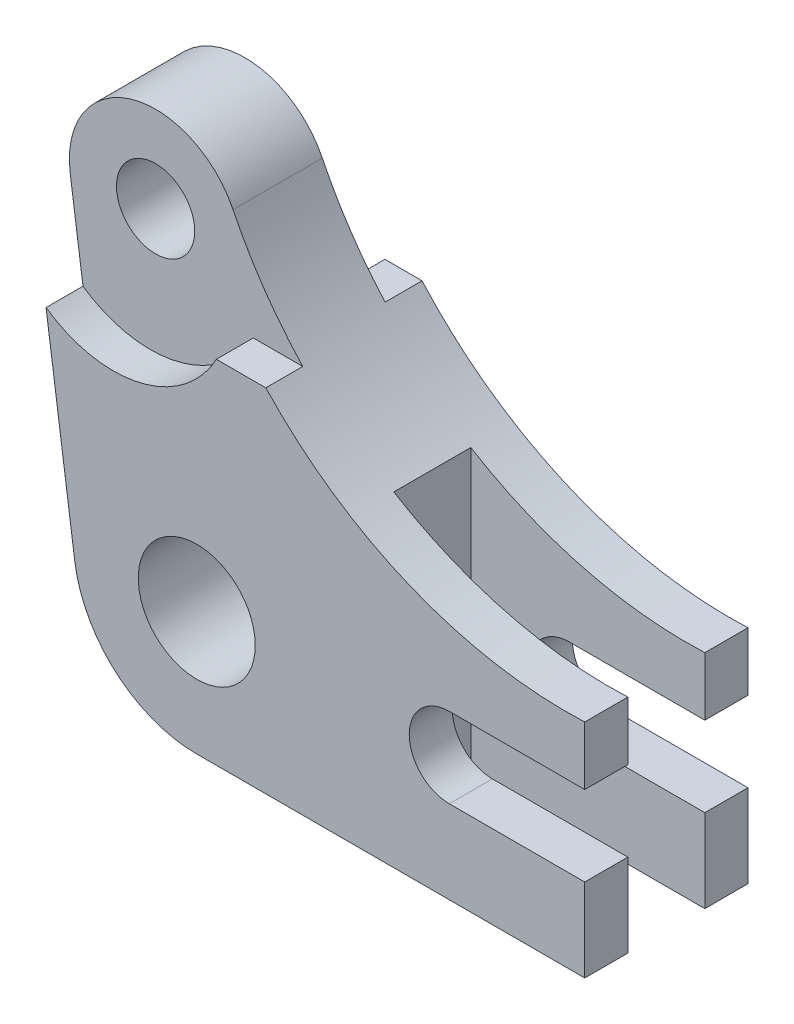
from build123d import *

# Parameters (mm, degrees)
SKETCH1_R           = 9.5
SKETCH1_R_2         = 6.35
BOSS_EXTRUDE1_DEPTH = 26.5
SKETCH4_W           = 12.5
SKETCH4_H           = 9.5
SKETCH4_H_2         = 13
SKETCH4_H_3         = 13.5
CUT_EXTRUDE2_DEPTH  = 38
SKETCH8_W           = 32.145016969
SKETCH8_H           = 12.5
CUT_EXTRUDE3_DEPTH  = 83.012755321
CUT_EXTRUDE4_START  = -6
SKETCH9_R           = 6.35
CUT_EXTRUDE4_DEPTH  = 6
SKETCH10_R          = 6.35
CUT_EXTRUDE5_DEPTH  = 6


with BuildPart() as part:
    # Sketch1 → Boss-Extrude1 (new body)
    with BuildSketch(Plane.XY):
        with BuildLine():
            Line((0, -20), (63, -20))
            Line((63, -20), (63, -6.5))
            Line((63, -6.5), (41, -6.5))
            ThreePointArc((41, -6.5), (34.5, 0), (41, 6.5))
            Line((41, 6.5), (63, 6.5))
            Line((63, 6.5), (63, 16))
            ThreePointArc((63, 16), (25.856630594, 25.331553649), (-0.107256868, 53.484427966))
            ThreePointArc((-0.107256868, 53.484427966), (-16.780403102, 60.717082184), (-26.547021707, 45.390038979))
            Line((-26.547021707, 45.390038979), (-19.806983567, -2.771895014))
            ThreePointArc((-19.806983567, -2.771895014), (-13.125587601, -15.09035951), (0, -20))
        make_face()
        Circle(SKETCH1_R, mode=Mode.SUBTRACT)
        with Locations((-12.68213321, 47.330365488)):
            Circle(SKETCH1_R_2, mode=Mode.SUBTRACT)
    extrude(amount=BOSS_EXTRUDE1_DEPTH)

    # Sketch4 → Cut-Extrude2 (cut)
    with BuildSketch(Plane(origin=(63, 0, 0), x_dir=(0, 0, -1), z_dir=(1, 0, 0))):
        with Locations((-13.25, 11.25)):
            Rectangle(SKETCH4_W, SKETCH4_H)
        with Locations((-13.25, 0)):
            Rectangle(SKETCH4_W, SKETCH4_H_2)
        with Locations((-13.25, -13.25)):
            Rectangle(SKETCH4_W, SKETCH4_H_3)
    extrude(amount=-CUT_EXTRUDE2_DEPTH, mode=Mode.SUBTRACT)

    # Sketch8 → Cut-Extrude3 (cut, through all)
    with BuildSketch(Plane.XZ.offset(-16)):
        with Locations((41.072508485, 13.25)):
            Rectangle(SKETCH8_W, SKETCH8_H)
    extrude(amount=-CUT_EXTRUDE3_DEPTH, mode=Mode.SUBTRACT)

    # Sketch9 → Cut-Extrude4 (cut)
    with BuildSketch(Plane.XY.offset(26.5).offset(CUT_EXTRUDE4_START)):
        with BuildLine():
            Line((3.183116996, 37.09445843), (11.209926645, 37.09445843))
            ThreePointArc((11.209926645, 37.09445843), (4.938887656, 44.866551764), (-0.107256868, 53.484427966))
            ThreePointArc((-0.107256868, 53.484427966), (-16.780403102, 60.717082184), (-26.547021707, 45.390038979))
            Line((-26.547021707, 45.390038979), (-24.469627112, 30.545710311))
            ThreePointArc((-24.469627112, 30.545710311), (-9.171593238, 27.605845104), (3.183116996, 37.09445843))
        make_face()
        with Locations((-12.68213321, 47.330365488)):
            Circle(SKETCH9_R, mode=Mode.SUBTRACT)
    extrude(amount=CUT_EXTRUDE4_DEPTH, mode=Mode.SUBTRACT)

    # Sketch10 → Cut-Extrude5 (cut)
    with BuildSketch(Plane(origin=(0, 0, 0), x_dir=(-1, 0, 0), z_dir=(0, 0, -1))):
        with BuildLine():
            ThreePointArc((0.107256868, 53.484427966), (-4.467284835, 45.558758862), (-10.079146539, 38.330365488))
            Line((-10.079146539, 38.330365488), (-4.051067321, 38.330365488))
            ThreePointArc((-4.051067321, 38.330365488), (9.019379836, 28.686754311), (24.7667399, 32.668773448))
            Line((24.7667399, 32.668773448), (26.547021707, 45.390038979))
            ThreePointArc((26.547021707, 45.390038979), (16.780403102, 60.717082184), (0.107256868, 53.484427966))
        make_face()
        with Locations((12.68213321, 47.330365488)):
            Circle(SKETCH10_R, mode=Mode.SUBTRACT)
    extrude(amount=-CUT_EXTRUDE5_DEPTH, mode=Mode.SUBTRACT)


solid = part.part
